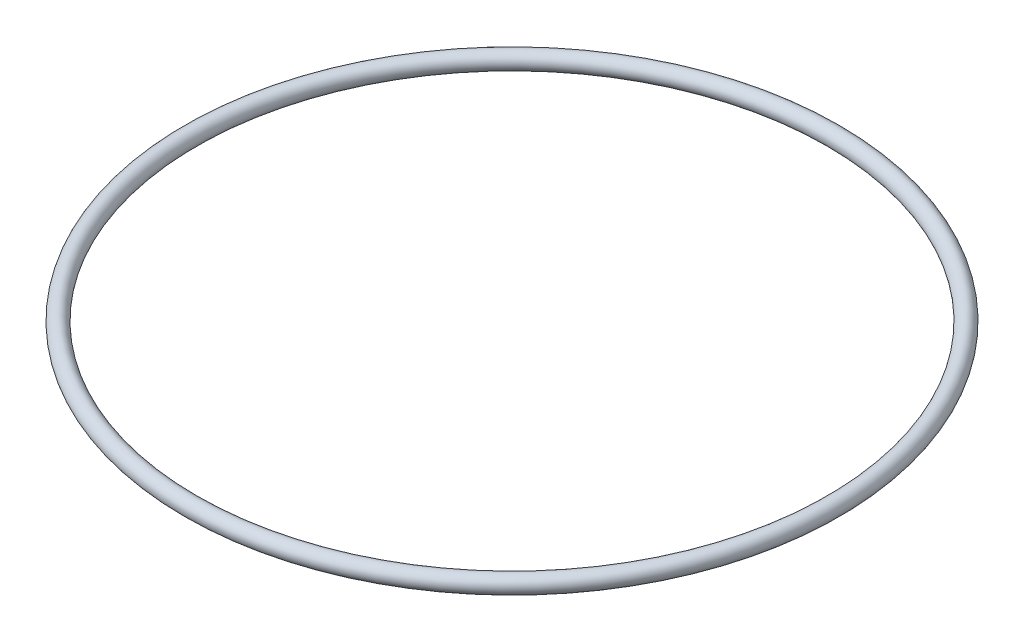
from build123d import *

# Parameters (mm, degrees)
ESBO_O1_R = 1.765


with BuildPart() as part:
    # Esboço1 → Revolução1 (revolve)
    with BuildSketch(Plane.XY, mode=Mode.PRIVATE) as revolu_o1_sk:
        with Locations((-66.65, 0)):
            Circle(ESBO_O1_R)
    revolve(revolu_o1_sk.sketch.rotate(Axis((0, -33.290702948, 0), (0, 1, 0)), 270), axis=Axis((0, -33.290702948, 0), (0, 1, 0)))


solid = part.part
